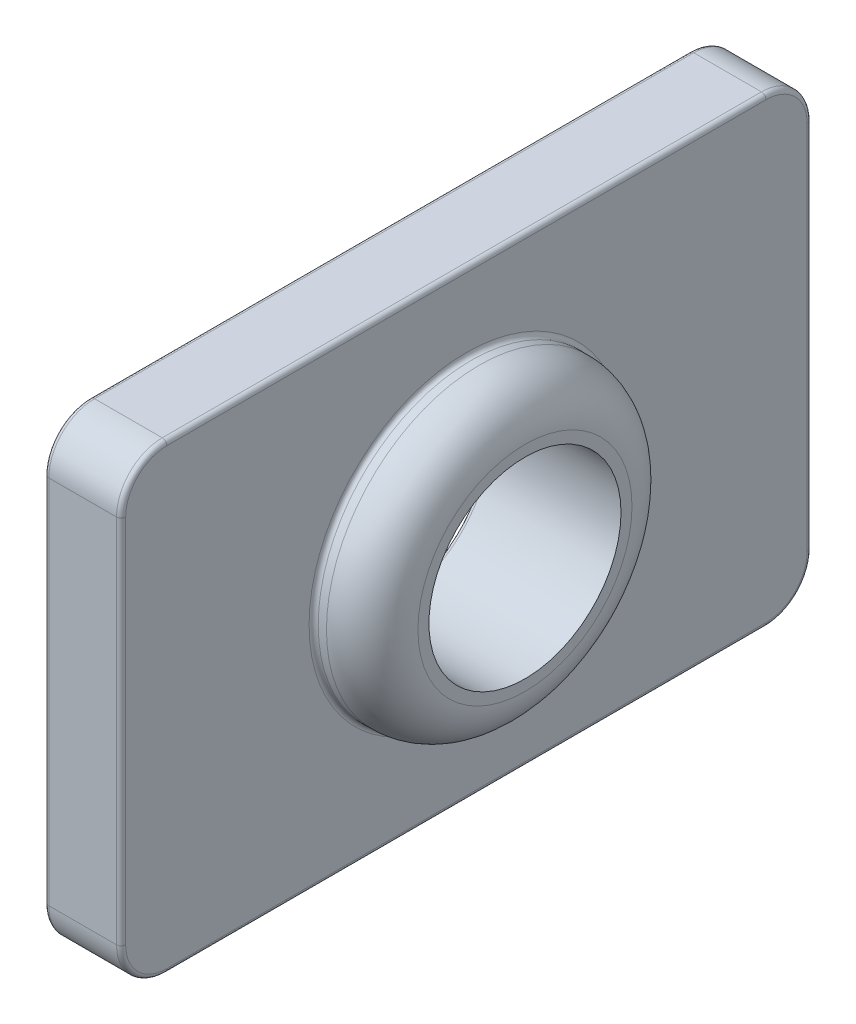
from build123d import *

# Parameters (mm, degrees)
SKETCH1_W             = 15.1
SKETCH1_H             = 10.1
BOSS_EXTRUDE1_DEPTH   = 1.68
SKETCH3_R             = 3.34
BOSS_EXTRUDE2_DEPTH   = 1.28
FILLET1_R             = 1
M5X0_8_TAPPED_HOLE1_D = 4.2
FILLET2_R             = 1
FILLET3_R             = 0.1


with BuildPart() as part:
    # Sketch1 → Boss-Extrude1 (new body)
    with BuildSketch(Plane(origin=(0, 0, 0), x_dir=(0, 0, -1), z_dir=(1, 0, 0))):
        Rectangle(SKETCH1_W, SKETCH1_H)
    extrude(amount=BOSS_EXTRUDE1_DEPTH)

    # Sketch3 → Boss-Extrude2 (add)
    with BuildSketch(Plane(origin=(1.68, 0, 0), x_dir=(0, 0, -1), z_dir=(1, 0, 0))):
        with Locations(Location((0, 0, 0), (0, 0, 180))):
            Circle(SKETCH3_R)
    extrude(amount=BOSS_EXTRUDE2_DEPTH)

    # Fillet1
    fillet1_edges = [part.edges().sort_by_distance(p)[0] for p in [
        (2.96, 0, -3.34),
    ]]
    fillet(fillet1_edges, radius=FILLET1_R)

    # M5x0.8 Tapped Hole1 (through all)
    with Locations(Plane(origin=(2.96, 0, 0), x_dir=(0, 0, -1), z_dir=(1, 0, 0))):
        with Locations((0, 0)):
            Hole(M5X0_8_TAPPED_HOLE1_D / 2)

    # Fillet2
    fillet2_edges = [part.edges().sort_by_distance(p)[0] for p in [
        (0.84, 5.05, 7.55),
        (0.84, 5.05, -7.55),
        (0.84, -5.05, -7.55),
        (0.84, -5.05, 7.55),
    ]]
    fillet(fillet2_edges, radius=FILLET2_R)

    # Fillet3
    fillet3_edges = [part.edges().sort_by_distance(p)[0] for p in [
        (1.68, 0, -3.34),
        (0, 0, -2.1),
        (0, -5.05, 0),
        (1.68, -5.05, 0),
        (0, 0, 7.55),
        (0, 5.05, 0),
        (0, 0, -7.55),
        (0, 4.757106781, 7.257106781),
        (0, 4.757106781, -7.257106781),
        (0, -4.757106781, -7.257106781),
        (0, -4.757106781, 7.257106781),
        (1.68, 0, 7.55),
        (1.68, 0, -7.55),
        (1.68, 5.05, 0),
        (1.68, 4.757106781, 7.257106781),
        (1.68, 4.757106781, -7.257106781),
        (1.68, -4.757106781, -7.257106781),
        (1.68, -4.757106781, 7.257106781),
    ]]
    fillet(fillet3_edges, radius=FILLET3_R)


solid = part.part
